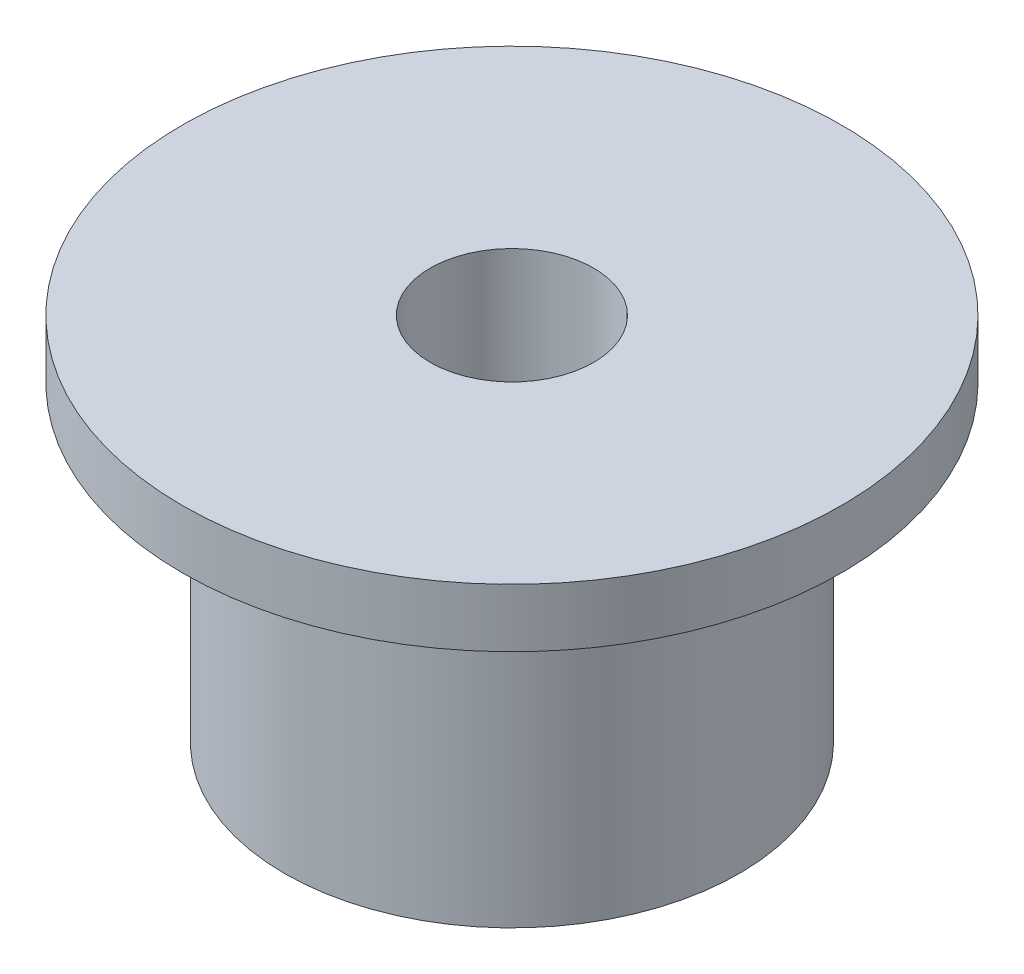
from build123d import *

# Parameters (mm, degrees)
SKETCH1_R           = 2.921
BOSS_EXTRUDE1_DEPTH = 4.000000128
SKETCH2_R           = 4.2333418
BOSS_EXTRUDE2_DEPTH = 0.7499985
SKETCH3_R           = 1.05
CUT_EXTRUDE1_DEPTH  = 8.642306756


with BuildPart() as part:
    # Sketch1 → Boss-Extrude1 (new body)
    with BuildSketch(Plane(origin=(0, 0, 0), x_dir=(1, 0, 0), z_dir=(0, 1, 0))):
        with Locations(Location((0, 0, 0), (0, 0, 270))):
            Circle(SKETCH1_R)
    extrude(amount=BOSS_EXTRUDE1_DEPTH)

    # Sketch2 → Boss-Extrude2 (add)
    with BuildSketch(Plane(origin=(0, 4.000000128, 0), x_dir=(1, 0, 0), z_dir=(0, 1, 0))):
        with Locations(Location((0, 0, 0), (0, 0, 270))):
            Circle(SKETCH2_R)
    extrude(amount=BOSS_EXTRUDE2_DEPTH)

    # Sketch3 → Cut-Extrude1 (cut, through all)
    with BuildSketch(Plane(origin=(0, 4.749998628, 0), x_dir=(1, 0, 0), z_dir=(0, 1, 0))):
        with Locations(Location((0, 0, 0), (0, 0, 270))):
            Circle(SKETCH3_R)
    extrude(amount=-CUT_EXTRUDE1_DEPTH, mode=Mode.SUBTRACT)


solid = part.part
